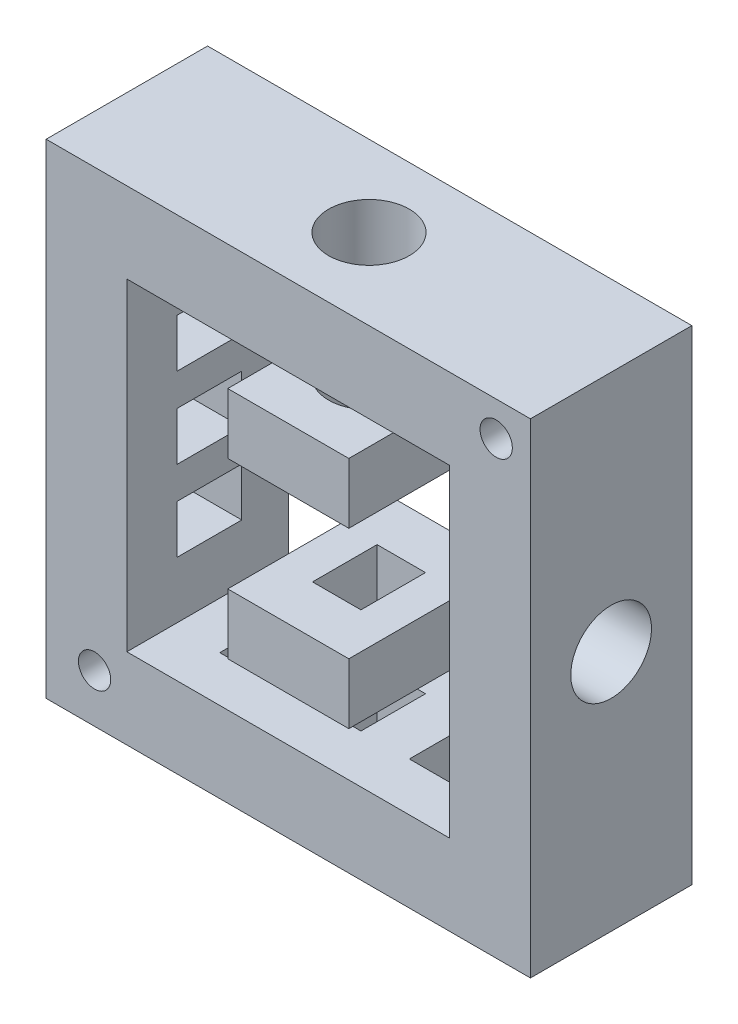
from build123d import *

# Parameters (mm, degrees)
SKETCH1_W             = 30
SKETCH1_H             = 30
BOSS_EXTRUDE1_DEPTH   = 10
SKETCH2_W             = 30
SKETCH2_H             = 30
SKETCH2_W_2           = 20
SKETCH2_H_2           = 20
BOSS_EXTRUDE2_DEPTH   = 10
SKETCH2_W_3           = 7.5
SKETCH2_H_3           = 3.748828889
BOSS_EXTRUDE2_2_DEPTH = 10
BOSS_EXTRUDE2_3_DEPTH = 10
SKETCH3_W             = 30
SKETCH3_H             = 30
BOSS_EXTRUDE3_DEPTH   = 10
SKETCH4_R             = 3.1
CUT_EXTRUDE1_DEPTH    = 10
SKETCH5_R             = 3.1
CUT_EXTRUDE2_DEPTH    = 10
CUT_EXTRUDE3_START    = -30
SKETCH8_R             = 1
CUT_EXTRUDE3_DEPTH    = 30
CUT_EXTRUDE5_START    = -11.5
SKETCH9_R             = 2.5
CUT_EXTRUDE5_DEPTH    = 11.5
SKETCH10_R            = 2.5
CUT_EXTRUDE6_DEPTH    = 10
SKETCH11_W            = 4
SKETCH11_H            = 3
CUT_EXTRUDE7_DEPTH    = 9
SKETCH13_W            = 3
SKETCH13_H            = 4
CUT_EXTRUDE9_DEPTH    = 13


with BuildPart() as part:
    # Sketch1 → Boss-Extrude1 (new body)
    with BuildSketch(Plane.XY):
        Rectangle(SKETCH1_W, SKETCH1_H)
    extrude(amount=BOSS_EXTRUDE1_DEPTH)

    # Sketch5 → Cut-Extrude2 (cut)
    with BuildSketch(Plane(origin=(0, 0, 0), x_dir=(-1, 0, 0), z_dir=(0, 0, -1))):
        with Locations((-6, -0.372899474)):
            Circle(SKETCH5_R)
    extrude(amount=-CUT_EXTRUDE2_DEPTH, mode=Mode.SUBTRACT)


with BuildPart() as body_2:
    # Sketch2 → Boss-Extrude2 (new body)
    with BuildSketch(Plane.XY.offset(10)):
        Rectangle(SKETCH2_W, SKETCH2_H)
        Rectangle(SKETCH2_W_2, SKETCH2_H_2, mode=Mode.SUBTRACT)
    extrude(amount=BOSS_EXTRUDE2_DEPTH)


with BuildPart() as body_3:
    # Sketch2 → Boss-Extrude2 2 (new body)
    with BuildSketch(Plane.XY.offset(10)):
        with Locations((0, 5.374414445)):
            Rectangle(SKETCH2_W_3, SKETCH2_H_3)
    extrude(amount=BOSS_EXTRUDE2_2_DEPTH)


with BuildPart() as body_4:
    # Sketch2 → Boss-Extrude2 3 (new body)
    with BuildSketch(Plane.XY.offset(10)):
        with Locations((0, -5.374414445)):
            Rectangle(SKETCH2_W_3, SKETCH2_H_3)
    extrude(amount=BOSS_EXTRUDE2_3_DEPTH)


with BuildPart() as body_5:
    # Sketch3 → Boss-Extrude3 (new body)
    with BuildSketch(Plane.XY.offset(20)):
        Rectangle(SKETCH3_W, SKETCH3_H)
    extrude(amount=BOSS_EXTRUDE3_DEPTH)

    # Sketch4 → Cut-Extrude1 (cut)
    with BuildSketch(Plane.XY.offset(30)):
        with Locations((-6, 0)):
            Circle(SKETCH4_R)
    extrude(amount=-CUT_EXTRUDE1_DEPTH, mode=Mode.SUBTRACT)


with BuildPart() as cut_extrude3_tool:
    # Sketch8 → Cut-Extrude3 (new body)
    with BuildSketch(Plane.XY.offset(30).offset(CUT_EXTRUDE3_START)):
        with Locations((-12, -12)):
            Circle(SKETCH8_R)
        with Locations((12.878679656, 12.878679656)):
            Circle(SKETCH8_R)
    extrude(amount=CUT_EXTRUDE3_DEPTH)


with BuildPart() as part_1:
    add(part.part)

    # Cut-Extrude3: cut by cut_extrude3_tool
    add(cut_extrude3_tool.part, mode=Mode.SUBTRACT)


with BuildPart() as body_2_1:
    add(body_2.part)

    # Cut-Extrude3: cut by cut_extrude3_tool
    add(cut_extrude3_tool.part, mode=Mode.SUBTRACT)


with BuildPart() as body_5_1:
    add(body_5.part)

    # Cut-Extrude3: cut by cut_extrude3_tool
    add(cut_extrude3_tool.part, mode=Mode.SUBTRACT)


with BuildPart() as cut_extrude5_tool:
    # Sketch9 → Cut-Extrude5 (new body)
    with BuildSketch(Plane(origin=(0, 15, 0), x_dir=(1, 0, 0), z_dir=(0, 1, 0)).offset(CUT_EXTRUDE5_START)):
        with Locations(Location((0, -15, 0), (0, 0, 270))):
            Circle(SKETCH9_R)
    extrude(amount=CUT_EXTRUDE5_DEPTH)


with BuildPart() as body_2_2:
    add(body_2_1.part)

    # Cut-Extrude5: cut by cut_extrude5_tool
    add(cut_extrude5_tool.part, mode=Mode.SUBTRACT)

    # Sketch10 → Cut-Extrude6 (cut)
    with BuildSketch(Plane(origin=(15, 0, 0), x_dir=(0, 0, -1), z_dir=(1, 0, 0))):
        with Locations(Location((-15, 0, 0), (0, 0, 90))):
            Circle(SKETCH10_R)
    extrude(amount=-CUT_EXTRUDE6_DEPTH, mode=Mode.SUBTRACT)

    # Sketch11 → Cut-Extrude7 (cut)
    with BuildSketch(Plane.ZY.offset(15)):
        with Locations((14.883452823, 5)):
            Rectangle(SKETCH11_W, SKETCH11_H)
        with Locations((14.883452823, 0)):
            Rectangle(SKETCH11_W, SKETCH11_H)
        with Locations((14.883452823, -4.985769597)):
            Rectangle(SKETCH11_W, SKETCH11_H)
    extrude(amount=-CUT_EXTRUDE7_DEPTH, mode=Mode.SUBTRACT)


with BuildPart() as body_3_1:
    add(body_3.part)

    # Cut-Extrude5: cut by cut_extrude5_tool
    add(cut_extrude5_tool.part, mode=Mode.SUBTRACT)


with BuildPart() as cut_extrude9_tool:
    # Sketch13 → Cut-Extrude9 (new body)
    with BuildSketch(Plane.XZ.offset(15)):
        with Locations((0, 15)):
            Rectangle(SKETCH13_W, SKETCH13_H)
        with Locations((6, 15)):
            Rectangle(SKETCH13_W, SKETCH13_H)
        with Locations((-5.576653418, 15.166702073)):
            Rectangle(SKETCH13_W, SKETCH13_H)
    extrude(amount=-CUT_EXTRUDE9_DEPTH)


with BuildPart() as body_2_3:
    add(body_2_2.part)

    # Cut-Extrude9: cut by cut_extrude9_tool
    add(cut_extrude9_tool.part, mode=Mode.SUBTRACT)


with BuildPart() as body_4_1:
    add(body_4.part)

    # Cut-Extrude9: cut by cut_extrude9_tool
    add(cut_extrude9_tool.part, mode=Mode.SUBTRACT)


solid = Compound([body_3_1.part, body_2_3.part, body_4_1.part])
